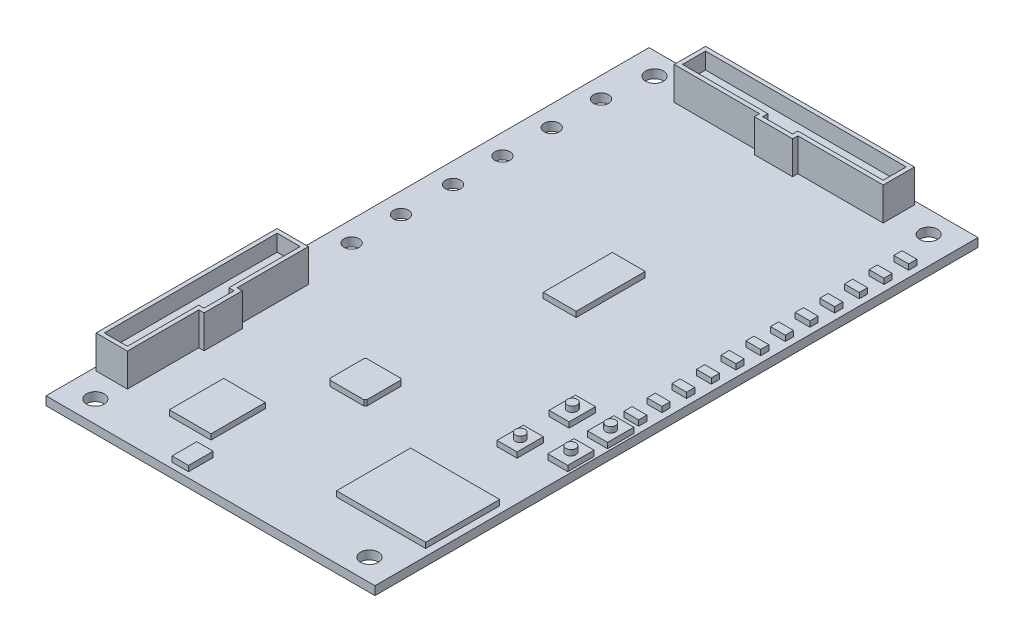
from build123d import *

# Parameters (mm, degrees)
SKETCH2_W           = 60
SKETCH2_H           = 110
BOSS_EXTRUDE1_DEPTH = 1.5748
BOSS_EXTRUDE2_DEPTH = 6
BOSS_EXTRUDE3_DEPTH = 6
SKETCH6_W           = 6
SKETCH6_H           = 12.6
SKETCH6_W_2         = 7.6
SKETCH6_H_2         = 9.9
SKETCH6_W_3         = 3
SKETCH6_H_3         = 4.5
SKETCH6_W_4         = 16.25
SKETCH6_H_4         = 13.5
SKETCH6_W_5         = 3.65
SKETCH6_H_5         = 4.8
BOSS_EXTRUDE4_DEPTH = 1
SKETCH7_R           = 1.375
SKETCH7_R_2         = 1.625
CUT_EXTRUDE1_DEPTH  = 126.443214245
SKETCH8_R           = 0.9
BOSS_EXTRUDE5_DEPTH = 1
SKETCH9_W           = 2.7
SKETCH9_H           = 1.5
BOSS_EXTRUDE6_DEPTH = 1
CUT_EXTRUDE2_DEPTH  = 3


with BuildPart() as part:
    # Sketch2 → Boss-Extrude1 (new body)
    with BuildSketch(Plane(origin=(0, 0, 0), x_dir=(1, 0, 0), z_dir=(0, 1, 0))):
        with Locations((30, 55)):
            Rectangle(SKETCH2_W, SKETCH2_H)
    extrude(amount=-BOSS_EXTRUDE1_DEPTH)

    # Sketch3 → Boss-Extrude2 (add)
    with BuildSketch(Plane(origin=(0, 0, 0), x_dir=(1, 0, 0), z_dir=(0, 1, 0))):
        Polygon((0.6425, 8.49), (6.3575, 8.49), (6.3575, 21.5075), (7.31, 21.5075), (7.31, 28.4925), (6.3575, 28.4925), (6.3575, 41.51), (0.6425, 41.51), align=None)
    extrude(amount=BOSS_EXTRUDE2_DEPTH)

    # Sketch5 → Boss-Extrude3 (add)
    with BuildSketch(Plane(origin=(0, 0, 0), x_dir=(1, 0, 0), z_dir=(0, 1, 0))):
        Polygon((49.05, 109.3575), (10.95, 109.3575), (10.95, 103.6425), (26.5075, 103.6425), (26.5075, 102.69), (33.4925, 102.69), (33.4925, 103.6425), (49.05, 103.6425), align=None)
    extrude(amount=BOSS_EXTRUDE3_DEPTH)

    # Sketch6 → Boss-Extrude4 (add)
    with BuildSketch(Plane(origin=(0, 0, 0), x_dir=(1, 0, 0), z_dir=(0, 1, 0))):
        with Locations((33, 67)):
            Rectangle(SKETCH6_W, SKETCH6_H)
        Polygon((30.875, 33.85), (30.875, 27.65), (30.6, 27.375), (24.4, 27.375), (24.125, 27.65), (24.125, 33.85), (24.4, 34.125), (30.6, 34.125), align=None)
        with Locations((18.25, 13)):
            Rectangle(SKETCH6_W_2, SKETCH6_H_2)
        with Locations((23.5, 3.25)):
            Rectangle(SKETCH6_W_3, SKETCH6_H_3)
        with Locations((50.625, 17.25)):
            Rectangle(SKETCH6_W_4, SKETCH6_H_4)
        with Locations((57.75, 38)):
            Rectangle(SKETCH6_W_5, SKETCH6_H_5)
        with Locations((57.75, 45.25)):
            Rectangle(SKETCH6_W_5, SKETCH6_H_5)
        with Locations((51, 45)):
            Rectangle(SKETCH6_W_5, SKETCH6_H_5)
        with Locations((51, 35.5)):
            Rectangle(SKETCH6_W_5, SKETCH6_H_5)
    extrude(amount=BOSS_EXTRUDE4_DEPTH)

    # Sketch7 → Cut-Extrude1 (cut, through all)
    with BuildSketch(Plane(origin=(0, 0, 0), x_dir=(1, 0, 0), z_dir=(0, 1, 0))):
        with Locations(Location((3.75, 52, 0), (0, 0, 270))):
            Circle(SKETCH7_R)
        with Locations(Location((3.75, 70.5, 0), (0, 0, 270))):
            Circle(SKETCH7_R)
        with Locations(Location((3.75, 79.5, 0), (0, 0, 270))):
            Circle(SKETCH7_R)
        with Locations(Location((3.75, 88.5, 0), (0, 0, 270))):
            Circle(SKETCH7_R)
        with Locations(Location((3.75, 97.5, 0), (0, 0, 270))):
            Circle(SKETCH7_R)
        with Locations(Location((3.75, 61, 0), (0, 0, 270))):
            Circle(SKETCH7_R)
        with Locations(Location((5, 106, 0), (0, 0, 270))):
            Circle(SKETCH7_R_2)
        with Locations(Location((55, 106, 0), (0, 0, 270))):
            Circle(SKETCH7_R_2)
        with Locations(Location((55, 4, 0), (0, 0, 270))):
            Circle(SKETCH7_R_2)
        with Locations(Location((5, 4, 0), (0, 0, 270))):
            Circle(SKETCH7_R_2)
    extrude(amount=-CUT_EXTRUDE1_DEPTH, mode=Mode.SUBTRACT)

    # Sketch8 → Boss-Extrude5 (add)
    with BuildSketch(Plane(origin=(0, 1, 0), x_dir=(1, 0, 0), z_dir=(0, 1, 0))):
        with Locations(Location((57.75, 38, 0), (0, 0, 270))):
            Circle(SKETCH8_R)
        with Locations(Location((57.75, 45.25, 0), (0, 0, 270))):
            Circle(SKETCH8_R)
        with Locations(Location((51, 45, 0), (0, 0, 270))):
            Circle(SKETCH8_R)
        with Locations(Location((51, 35.5, 0), (0, 0, 270))):
            Circle(SKETCH8_R)
    extrude(amount=BOSS_EXTRUDE5_DEPTH)

    # Sketch9 → Boss-Extrude6 (add)
    with BuildSketch(Plane(origin=(0, 0, 0), x_dir=(1, 0, 0), z_dir=(0, 1, 0))):
        with Locations((57.5, 50)):
            Rectangle(SKETCH9_W, SKETCH9_H)
        with Locations((57.5, 54.25)):
            Rectangle(SKETCH9_W, SKETCH9_H)
        with Locations((57.5, 58.75)):
            Rectangle(SKETCH9_W, SKETCH9_H)
        with Locations((57.5, 63.25)):
            Rectangle(SKETCH9_W, SKETCH9_H)
        with Locations((57.5, 67.75)):
            Rectangle(SKETCH9_W, SKETCH9_H)
        with Locations((57.5, 72.25)):
            Rectangle(SKETCH9_W, SKETCH9_H)
        with Locations((57.5, 76.75)):
            Rectangle(SKETCH9_W, SKETCH9_H)
        with Locations((57.5, 81.25)):
            Rectangle(SKETCH9_W, SKETCH9_H)
        with Locations((57.5, 85.75)):
            Rectangle(SKETCH9_W, SKETCH9_H)
        with Locations((57.5, 90.25)):
            Rectangle(SKETCH9_W, SKETCH9_H)
        with Locations((57.5, 94.75)):
            Rectangle(SKETCH9_W, SKETCH9_H)
        with Locations((57.5, 99.25)):
            Rectangle(SKETCH9_W, SKETCH9_H)
    extrude(amount=BOSS_EXTRUDE6_DEPTH)

    # Sketch10 → Cut-Extrude2 (cut)
    with BuildSketch(Plane(origin=(0, 6, 0), x_dir=(1, 0, 0), z_dir=(0, 1, 0))):
        Polygon((1.3925, 40.76), (1.3925, 9.24), (5.6075, 9.24), (5.6075, 22.2575), (6.56, 22.2575), (6.56, 27.7425), (5.6075, 27.7425), (5.6075, 40.76), align=None)
        Polygon((32.7425, 104.3925), (48.3, 104.3925), (48.3, 108.6075), (11.7, 108.6075), (11.7, 104.3925), (27.2575, 104.3925), (27.2575, 103.44), (32.7425, 103.44), align=None)
    extrude(amount=-CUT_EXTRUDE2_DEPTH, mode=Mode.SUBTRACT)


solid = part.part
